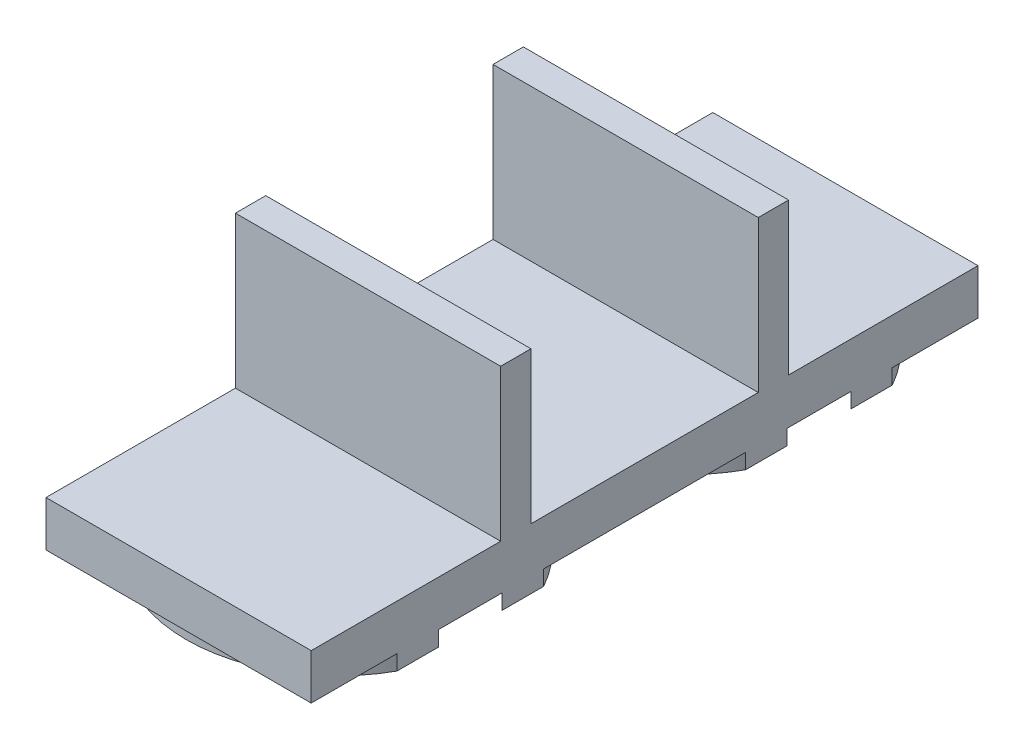
from build123d import *

# Parameters (mm, degrees)
EXTRUDE_1_DEPTH = 35
EXTRUDE_2_DEPTH = 2


with BuildPart() as part:
    # 草图1 → 凸台-拉伸1 (new body)
    with BuildSketch(Plane(origin=(0, 0, 0), x_dir=(0, 0, -1), z_dir=(1, 0, 0))):
        Polygon((-44, 0), (44, 0), (44, 6), (19, 6), (19, 26), (15, 26), (15, 6), (-15, 6), (-15, 26), (-19, 26), (-19, 6), (-44, 6), align=None)
    extrude(amount=EXTRUDE_1_DEPTH)

    # 草图2 → 凸台-拉伸2 (add)
    with BuildSketch(Plane.XZ):
        with BuildLine():
            Line((35, 27.213074887), (35, 32.682458366))
            ThreePointArc((35, 32.682458366), (17.5, 43), (0, 32.682458366))
            Line((0, 32.682458366), (0, 27.213074887))
            ThreePointArc((0, 27.213074887), (17.5, 41), (35, 27.213074887))
        make_face()
        with BuildLine():
            Line((35, 13.317541634), (35, 18.786925113))
            ThreePointArc((35, 18.786925113), (17.5, 5), (0, 18.786925113))
            Line((0, 18.786925113), (0, 13.317541634))
            ThreePointArc((0, 13.317541634), (17.5, 3), (35, 13.317541634))
        make_face()
        with BuildLine():
            Line((35, -18.786925113), (35, -13.317541634))
            ThreePointArc((35, -13.317541634), (17.5, -3), (0, -13.317541634))
            Line((0, -13.317541634), (0, -18.786925113))
            ThreePointArc((0, -18.786925113), (17.5, -5), (35, -18.786925113))
        make_face()
        with BuildLine():
            Line((0, -27.213074887), (0, -32.682458366))
            ThreePointArc((0, -32.682458366), (17.5, -43), (35, -32.682458366))
            Line((35, -32.682458366), (35, -27.213074887))
            ThreePointArc((35, -27.213074887), (17.5, -41), (0, -27.213074887))
        make_face()
    extrude(amount=EXTRUDE_2_DEPTH)


solid = part.part
